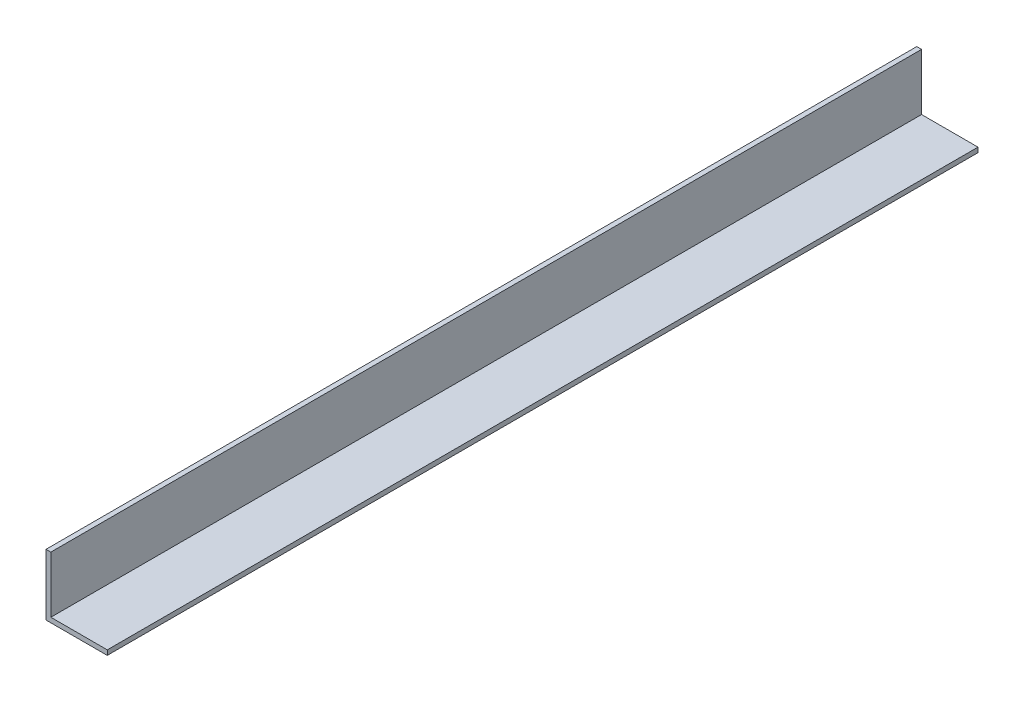
from build123d import *

# Parameters (mm, degrees)
SALIENTE_EXTRUIR1_DEPTH = 361


with BuildPart() as part:
    # Croquis1 → Saliente-Extruir1 (new body)
    with BuildSketch(Plane.XY):
        Polygon((0, 0), (0, 25.4), (2, 25.4), (2, 2), (25.4, 2), (25.4, 0), align=None)
    extrude(amount=SALIENTE_EXTRUIR1_DEPTH)


solid = part.part
